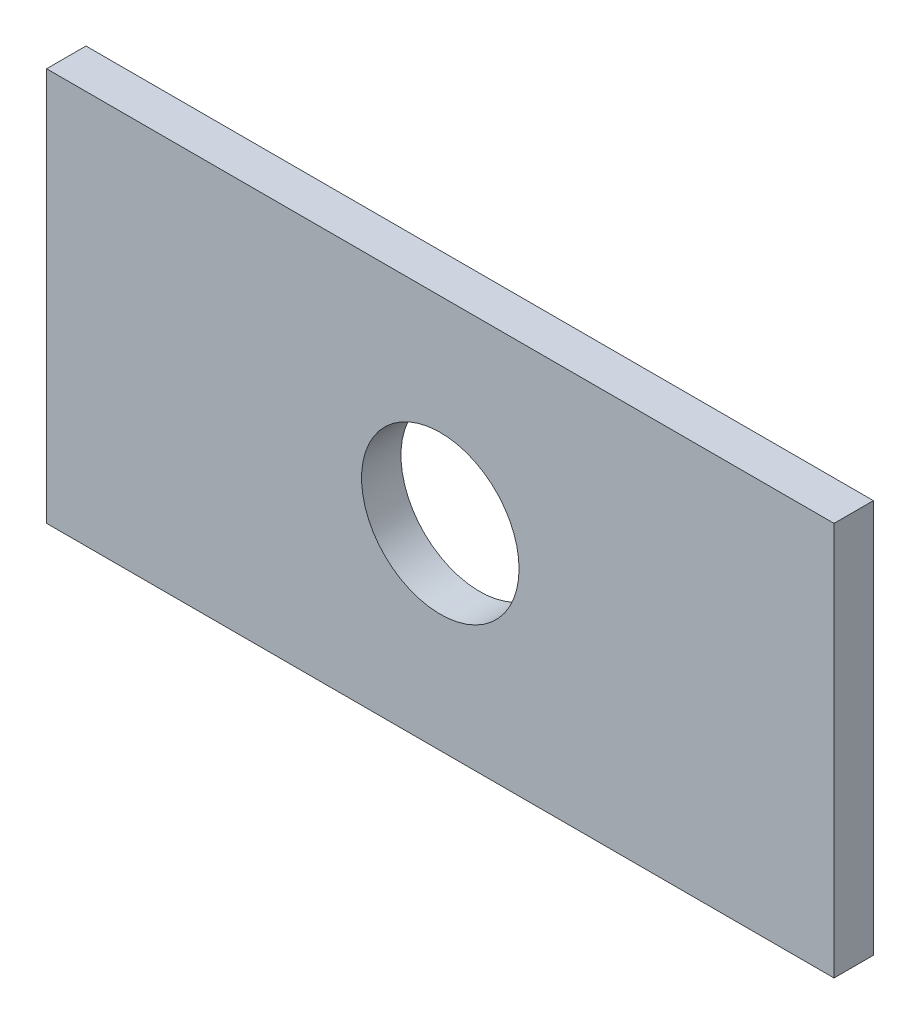
from build123d import *

# Parameters (mm, degrees)
SKETCH1_W          = 200
SKETCH1_H          = 100
EXTRUDE1_DEPTH     = 10
SKETCH2_R          = 20
CUT_EXTRUDE1_DEPTH = 113.249721603


with BuildPart() as part:
    # Sketch1 → Extrude1 (new body)
    with BuildSketch(Plane.XY):
        Rectangle(SKETCH1_W, SKETCH1_H)
    extrude(amount=EXTRUDE1_DEPTH)

    # Sketch2 → Cut-Extrude1 (cut, through all)
    with BuildSketch(Plane.XY.offset(10)):
        Circle(SKETCH2_R)
    extrude(amount=-CUT_EXTRUDE1_DEPTH, mode=Mode.SUBTRACT)


solid = part.part
